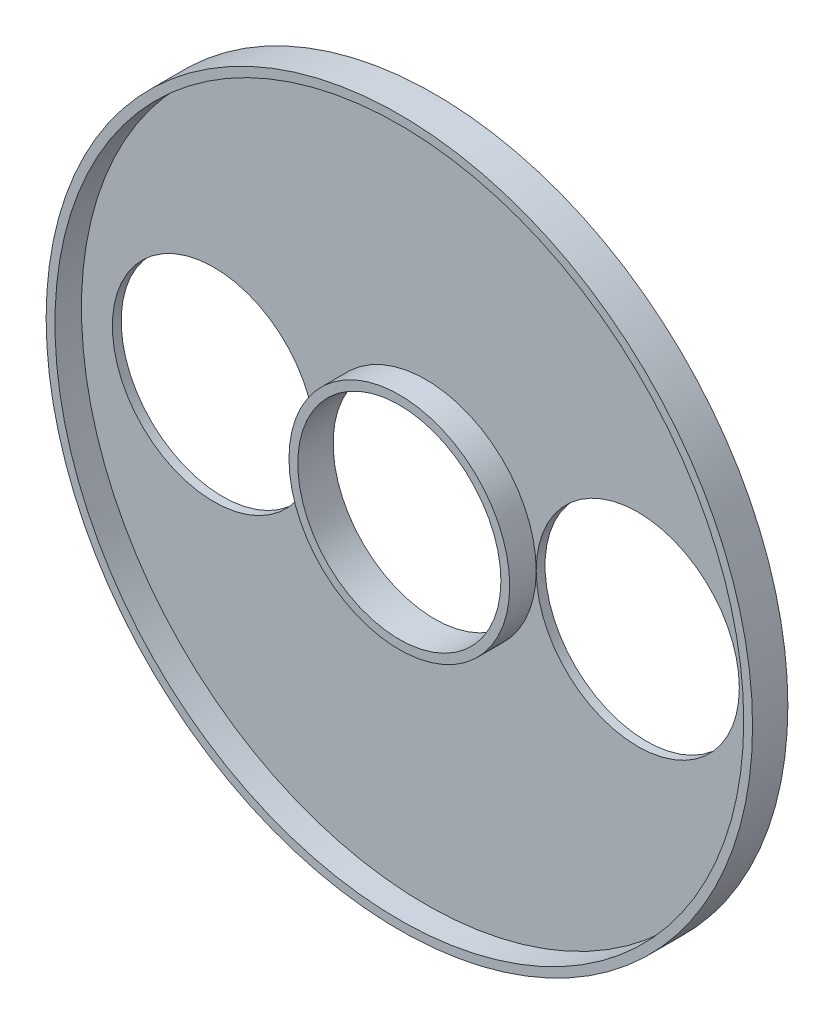
from build123d import *

# Parameters (mm, degrees)
PLENUM_BACKPLATE_START  = -57
SKETCH_1_R              = 80
SKETCH_1_R_2            = 23
PLENUM_BACKPLATE_DEPTH  = 2
PLENUM_OUTER_WALL_START = -57
SKETCH_2_R              = 80
SKETCH_2_R_2            = 78
PLENUM_OUTER_WALL_DEPTH = 8
PLENUM_INNER_WALL_START = -57
SKETCH_3_R              = 25
SKETCH_3_R_2            = 23
PLENUM_INNER_WALL_DEPTH = 8
SKETCH_4_R              = 23
THROUGH_HOLES_DEPTH     = 100


with BuildPart() as part:
    # Эскиз1 → Plenum_backplate (new body)
    with BuildSketch(Plane.XY.offset(PLENUM_BACKPLATE_START)):
        Circle(SKETCH_1_R)
        Circle(SKETCH_1_R_2, mode=Mode.SUBTRACT)
    extrude(amount=PLENUM_BACKPLATE_DEPTH)

    # Эскиз2 → Plenum_outer_wall (add)
    with BuildSketch(Plane.XY.offset(PLENUM_OUTER_WALL_START)):
        Circle(SKETCH_2_R)
        Circle(SKETCH_2_R_2, mode=Mode.SUBTRACT)
    extrude(amount=PLENUM_OUTER_WALL_DEPTH)

    # Эскиз3 → Plenum_inner_wall (add)
    with BuildSketch(Plane.XY.offset(PLENUM_INNER_WALL_START)):
        Circle(SKETCH_3_R)
        Circle(SKETCH_3_R_2, mode=Mode.SUBTRACT)
    extrude(amount=PLENUM_INNER_WALL_DEPTH)

    # Эскиз4 → Through_holes (cut, symmetric)
    with BuildSketch(Plane.XY):
        with Locations((-48, 0)):
            Circle(SKETCH_4_R)
        with Locations((48, 0)):
            Circle(SKETCH_4_R)
    extrude(amount=THROUGH_HOLES_DEPTH, both=True, mode=Mode.SUBTRACT)


solid = part.part
